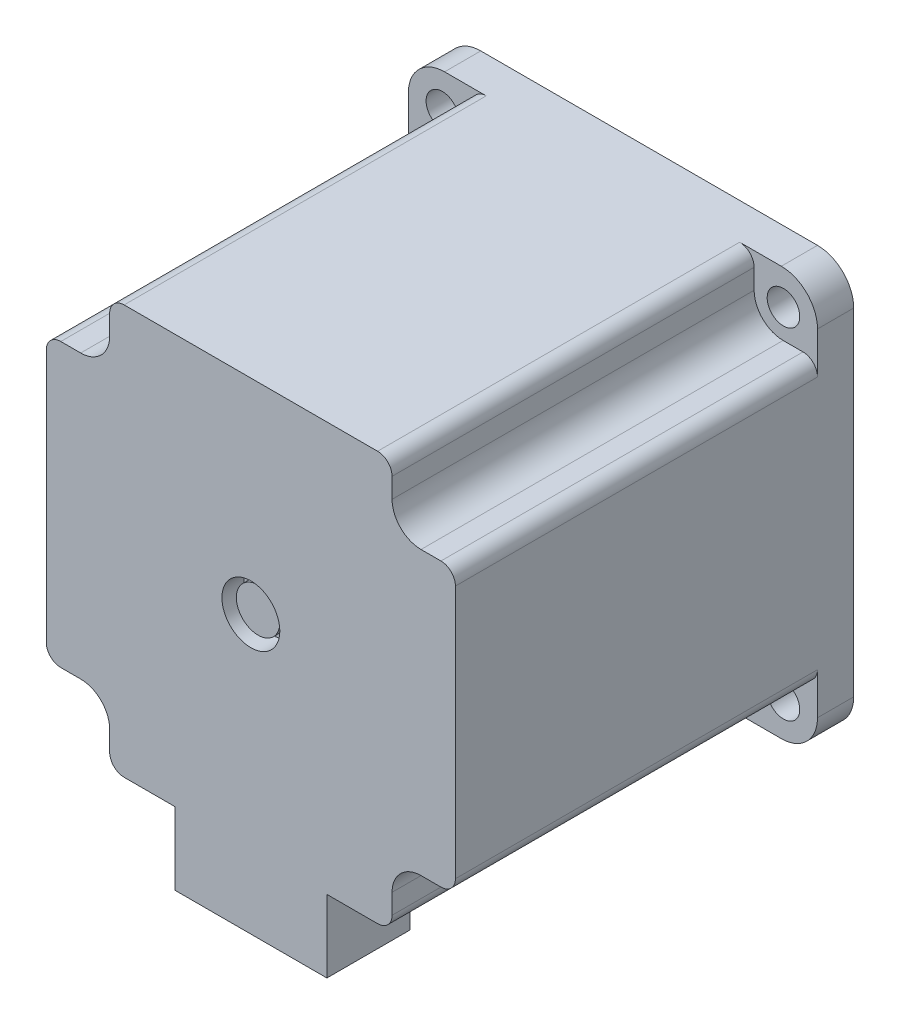
from build123d import *

# Parameters (mm, degrees)
SKETCH_1_W          = 56.5
SKETCH_1_H          = 56.5
EXTRUDE_1_DEPTH     = 55
FILLET_1_R          = 5
SKETCH_2_W          = 27.937414654
SKETCH_2_H          = 17.525111135
CUT_EXTRUDE_1_DEPTH = 50
FILLET_2_R          = 4
FILLET_3_R          = 2
SKETCH_3_R          = 19
EXTRUDE_2_DEPTH     = 1.5
SKETCH_4_R          = 4
CUT_EXTRUDE_2_DEPTH = 3
SKETCH_5_R          = 3
EXTRUDE_3_DEPTH     = 2
SKETCH_6_R          = 3.175
EXTRUDE_4_DEPTH     = 21
SKETCH_7_R          = 2.25
CUT_EXTRUDE_3_DEPTH = 21
SKETCH_8_W          = 21
SKETCH_8_H          = 11.5
EXTRUDE_5_DEPTH     = 10
SKETCH_9_W          = 12
SKETCH_9_H          = 3
CUT_EXTRUDE_4_DEPTH = 5


with BuildPart() as part:
    # 草图1 → 凸台-拉伸1 (new body)
    with BuildSketch(Plane.XY):
        with Locations((28.25, 28.25)):
            Rectangle(SKETCH_1_W, SKETCH_1_H)
    extrude(amount=EXTRUDE_1_DEPTH)

    # 圆角1
    fillet_1_edges = [part.edges().sort_by_distance(p)[0] for p in [
        (0, 56.5, 27.5),
        (56.5, 56.5, 27.5),
        (56.5, 0, 27.5),
        (0, 0, 27.5),
    ]]
    fillet(fillet_1_edges, radius=FILLET_1_R)

    # 草图2 → 切除-拉伸1 (cut)
    with BuildSketch(Plane.XY.offset(55)):
        with Locations((-5.218707327, 56.512555568)):
            Rectangle(SKETCH_2_W, SKETCH_2_H)
        with Locations((61.718707327, 56.512555568)):
            Rectangle(SKETCH_2_W, SKETCH_2_H)
        with Locations((61.718707327, -0.012555568)):
            Rectangle(SKETCH_2_W, SKETCH_2_H)
        with Locations((-5.218707327, -0.012555568)):
            Rectangle(SKETCH_2_W, SKETCH_2_H)
    extrude(amount=-CUT_EXTRUDE_1_DEPTH, mode=Mode.SUBTRACT)

    # 圆角2
    fillet_2_edges = [part.edges().sort_by_distance(p)[0] for p in [
        (8.75, 8.75, 30),
        (8.75, 47.75, 30),
        (47.75, 47.75, 30),
        (47.75, 8.75, 30),
    ]]
    fillet(fillet_2_edges, radius=FILLET_2_R)

    # 圆角3
    fillet_3_edges = [part.edges().sort_by_distance(p)[0] for p in [
        (0, 8.75, 30),
        (8.75, 0, 30),
        (8.75, 56.5, 30),
        (0, 47.75, 30),
        (56.5, 47.75, 30),
        (47.75, 56.5, 30),
        (47.75, 0, 30),
        (56.5, 8.75, 30),
    ]]
    fillet(fillet_3_edges, radius=FILLET_3_R)

    # 草图3 → 凸台-拉伸2 (add)
    with BuildSketch(Plane(origin=(0, 0, 0), x_dir=(-1, 0, 0), z_dir=(0, 0, -1))):
        with Locations((-28.25, 28.25)):
            Circle(SKETCH_3_R)
    extrude(amount=EXTRUDE_2_DEPTH)

    # 草图4 → 切除-拉伸2 (cut)
    with BuildSketch(Plane.XY.offset(55)):
        with Locations((28.25, 28.25)):
            Circle(SKETCH_4_R)
    extrude(amount=-CUT_EXTRUDE_2_DEPTH, mode=Mode.SUBTRACT)

    # 草图5 → 凸台-拉伸3 (add)
    with BuildSketch(Plane.XY.offset(52)):
        with Locations((28.25, 28.25)):
            Circle(SKETCH_5_R)
    extrude(amount=EXTRUDE_3_DEPTH)

    # 草图6 → 凸台-拉伸4 (add)
    with BuildSketch(Plane(origin=(0, 0, -1.5), x_dir=(-1, 0, 0), z_dir=(0, 0, -1))):
        with Locations(Location((-28.25, 28.25, 0), (0, 0, 180))):
            Circle(SKETCH_6_R)
    extrude(amount=EXTRUDE_4_DEPTH)

    # 草图7 → 切除-拉伸3 (cut)
    with BuildSketch(Plane(origin=(0, 0, 0), x_dir=(-1, 0, 0), z_dir=(0, 0, -1))):
        with Locations((-51.8, 4.75)):
            Circle(SKETCH_7_R)
        with Locations((-4.7, 4.75)):
            Circle(SKETCH_7_R)
        with Locations((-4.7, 51.75)):
            Circle(SKETCH_7_R)
        with Locations((-51.8, 51.75)):
            Circle(SKETCH_7_R)
    extrude(amount=-CUT_EXTRUDE_3_DEPTH, mode=Mode.SUBTRACT)

    # 草图8 → 凸台-拉伸5 (add)
    with BuildSketch(Plane.XZ):
        with Locations((28.25, 49.25)):
            Rectangle(SKETCH_8_W, SKETCH_8_H)
    extrude(amount=EXTRUDE_5_DEPTH)

    # 草图9 → 切除-拉伸4 (cut)
    with BuildSketch(Plane.XZ.offset(10)):
        with Locations((28.25, 46)):
            Rectangle(SKETCH_9_W, SKETCH_9_H)
    extrude(amount=-CUT_EXTRUDE_4_DEPTH, mode=Mode.SUBTRACT)


solid = part.part
